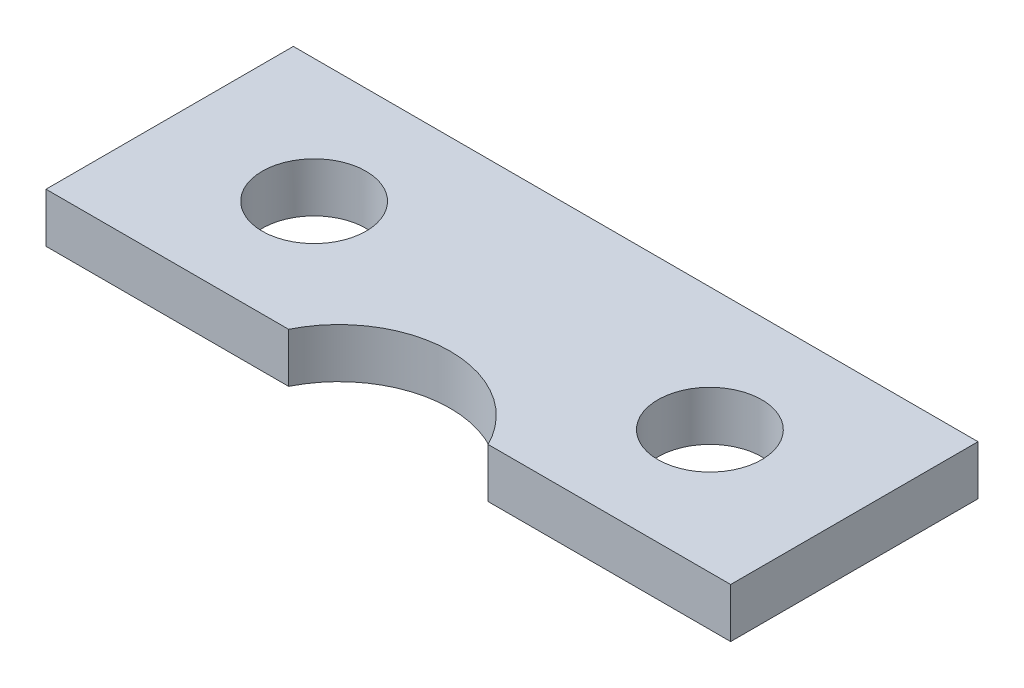
from build123d import *

# Parameters (mm, degrees)
SKETCH1_W           = 27.68
SKETCH1_H           = 10
BOSS_EXTRUDE1_DEPTH = 2
CUT_EXTRUDE1_REACH  = 16.851
SKETCH2_R           = 2.1
CUT_EXTRUDE2_REACH  = 16.851
SKETCH3_R           = 4.5


with BuildPart() as part:
    # Sketch1 → Boss-Extrude1 (new body)
    with BuildSketch(Plane(origin=(0, 0, 0), x_dir=(1, 0, 0), z_dir=(0, 1, 0))):
        Rectangle(SKETCH1_W, SKETCH1_H)
    extrude(amount=BOSS_EXTRUDE1_DEPTH)

    # Sketch2 → Cut-Extrude1 (cut, up to next)
    with BuildSketch(Plane(origin=(0, 2, 0), x_dir=(1, 0, 0), z_dir=(0, 1, 0)), mode=Mode.PRIVATE) as cut_extrude1_sk1:
        with Locations(Location((8, 0, 0), (0, 0, 270))):
            Circle(SKETCH2_R)
    cut_extrude1_tool1 = extrude(cut_extrude1_sk1.sketch, amount=-CUT_EXTRUDE1_REACH, mode=Mode.PRIVATE) & part.part
    # Sketch2 → Cut-Extrude1 (cut, up to next)
    with BuildSketch(Plane(origin=(0, 2, 0), x_dir=(1, 0, 0), z_dir=(0, 1, 0)), mode=Mode.PRIVATE) as cut_extrude1_sk2:
        with Locations(Location((-8, 0, 0), (0, 0, 270))):
            Circle(SKETCH2_R)
    cut_extrude1_tool2 = extrude(cut_extrude1_sk2.sketch, amount=-CUT_EXTRUDE1_REACH, mode=Mode.PRIVATE) & part.part
    add(cut_extrude1_tool1.solids().sort_by_distance((8, 2, 0))[0], mode=Mode.SUBTRACT)
    add(cut_extrude1_tool2.solids().sort_by_distance((-8, 2, 0))[0], mode=Mode.SUBTRACT)

    # Sketch3 → Cut-Extrude2 (cut, up to next)
    with BuildSketch(Plane.XZ, mode=Mode.PRIVATE) as cut_extrude2_sk1:
        with Locations((0, 7)):
            Circle(SKETCH3_R)
    cut_extrude2_tool1 = extrude(cut_extrude2_sk1.sketch, amount=-CUT_EXTRUDE2_REACH, mode=Mode.PRIVATE) & part.part
    add(cut_extrude2_tool1.solids().sort_by_distance((0, 0, 7))[0], mode=Mode.SUBTRACT)


solid = part.part
